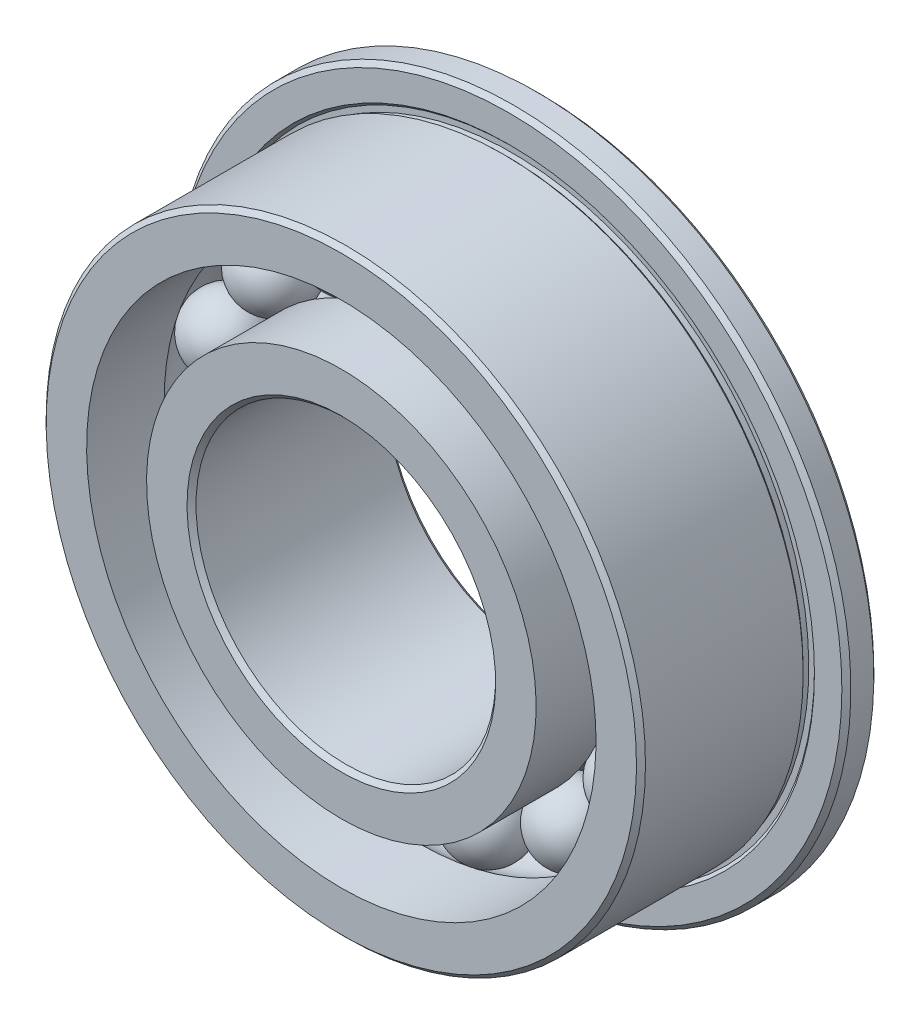
from build123d import *

# Parameters (mm, degrees)
FILLET1_SIZE      = 0.0714375
FILLET2_SIZE      = 0.0714375
CIRPATTERN3_COUNT = 15


with BuildPart() as part:
    # Sketch2 → Revolve1 (revolve)
    with BuildSketch(Plane(origin=(0, 0, 0), x_dir=(0, 0, -1), z_dir=(1, 0, 0))):
        with BuildLine():
            Line((1.5875, 5.3594), (1.0795, 5.3594))
            Line((1.0795, 5.3594), (1.0795, 4.852302561))
            Line((1.0795, 4.852302561), (1.124401281, 4.807401281))
            Line((1.124401281, 4.807401281), (1.124401281, 4.717598719))
            Line((1.124401281, 4.717598719), (1.034598719, 4.717598719))
            Line((1.034598719, 4.717598719), (0.989697439, 4.7625))
            Line((0.989697439, 4.7625), (-1.5875, 4.7625))
            Line((-1.5875, 4.7625), (-1.5875, 4.048125))
            Line((-1.5875, 4.048125), (-0.3571875, 4.048125))
            ThreePointArc((-0.3571875, 4.048125), (0, 4.1671875), (0.3571875, 4.048125))
            Line((0.3571875, 4.048125), (1.5875, 4.048125))
            Line((1.5875, 4.048125), (1.5875, 5.3594))
        make_face()
        with BuildLine():
            Line((1.5875, 2.38125), (-1.5875, 2.38125))
            Line((-1.5875, 2.38125), (-1.5875, 3.095625))
            Line((-1.5875, 3.095625), (-0.3571875, 3.095625))
            ThreePointArc((-0.3571875, 3.095625), (0, 2.9765625), (0.3571875, 3.095625))
            Line((0.3571875, 3.095625), (1.5875, 3.095625))
            Line((1.5875, 3.095625), (1.5875, 2.38125))
        make_face()
    revolve(axis=Axis((0, 0, 0), (0, 0, -1)))

    # Fillet1
    fillet1_edges = [part.edges().sort_by_distance(p)[0] for p in [
        (0, -5.3594, -1.5875),
        (0, -5.3594, -1.0795),
        (0, -4.7625, 1.5875),
    ]]
    chamfer(fillet1_edges, length=FILLET1_SIZE)

    # Fillet2
    fillet2_edges = [part.edges().sort_by_distance(p)[0] for p in [
        (0, -2.38125, -1.5875),
        (0, -2.38125, 1.5875),
    ]]
    chamfer(fillet2_edges, length=FILLET2_SIZE)


with BuildPart() as body_2:
    # Sketch7 → Revolve3 (revolve)
    with BuildSketch(Plane.XY):
        with BuildLine():
            Line((0, 4.1671875), (0, 2.9765625))
            ThreePointArc((0, 2.9765625), (-0.5953125, 3.571875), (0, 4.1671875))
        make_face()
    revolve(axis=Axis((0, 4.1671875, 0), (0, -1, 0)))


with BuildPart() as cirpattern3_1:
    # CirPattern3: pattern copy
    add(body_2.part.rotate(Axis((0, 0, 0), (0, 0, -1)), 1 * 360 / CIRPATTERN3_COUNT))


with BuildPart() as cirpattern3_2:
    # CirPattern3: pattern copy
    add(body_2.part.rotate(Axis((0, 0, 0), (0, 0, -1)), 2 * 360 / CIRPATTERN3_COUNT))


with BuildPart() as cirpattern3_3:
    # CirPattern3: pattern copy
    add(body_2.part.rotate(Axis((0, 0, 0), (0, 0, -1)), 3 * 360 / CIRPATTERN3_COUNT))


with BuildPart() as cirpattern3_4:
    # CirPattern3: pattern copy
    add(body_2.part.rotate(Axis((0, 0, 0), (0, 0, -1)), 4 * 360 / CIRPATTERN3_COUNT))


with BuildPart() as cirpattern3_5:
    # CirPattern3: pattern copy
    add(body_2.part.rotate(Axis((0, 0, 0), (0, 0, -1)), 5 * 360 / CIRPATTERN3_COUNT))


with BuildPart() as cirpattern3_6:
    # CirPattern3: pattern copy
    add(body_2.part.rotate(Axis((0, 0, 0), (0, 0, -1)), 6 * 360 / CIRPATTERN3_COUNT))


with BuildPart() as cirpattern3_7:
    # CirPattern3: pattern copy
    add(body_2.part.rotate(Axis((0, 0, 0), (0, 0, -1)), 7 * 360 / CIRPATTERN3_COUNT))


with BuildPart() as cirpattern3_8:
    # CirPattern3: pattern copy
    add(body_2.part.rotate(Axis((0, 0, 0), (0, 0, -1)), 8 * 360 / CIRPATTERN3_COUNT))


with BuildPart() as cirpattern3_9:
    # CirPattern3: pattern copy
    add(body_2.part.rotate(Axis((0, 0, 0), (0, 0, -1)), 9 * 360 / CIRPATTERN3_COUNT))


with BuildPart() as cirpattern3_10:
    # CirPattern3: pattern copy
    add(body_2.part.rotate(Axis((0, 0, 0), (0, 0, -1)), 10 * 360 / CIRPATTERN3_COUNT))


with BuildPart() as cirpattern3_11:
    # CirPattern3: pattern copy
    add(body_2.part.rotate(Axis((0, 0, 0), (0, 0, -1)), 11 * 360 / CIRPATTERN3_COUNT))


with BuildPart() as cirpattern3_12:
    # CirPattern3: pattern copy
    add(body_2.part.rotate(Axis((0, 0, 0), (0, 0, -1)), 12 * 360 / CIRPATTERN3_COUNT))


with BuildPart() as cirpattern3_13:
    # CirPattern3: pattern copy
    add(body_2.part.rotate(Axis((0, 0, 0), (0, 0, -1)), 13 * 360 / CIRPATTERN3_COUNT))


with BuildPart() as cirpattern3_14:
    # CirPattern3: pattern copy
    add(body_2.part.rotate(Axis((0, 0, 0), (0, 0, -1)), 14 * 360 / CIRPATTERN3_COUNT))


solid = Compound([part.part, body_2.part, cirpattern3_1.part, cirpattern3_2.part, cirpattern3_3.part, cirpattern3_4.part, cirpattern3_5.part, cirpattern3_6.part, cirpattern3_7.part, cirpattern3_8.part, cirpattern3_9.part, cirpattern3_10.part, cirpattern3_11.part, cirpattern3_12.part, cirpattern3_13.part, cirpattern3_14.part])
